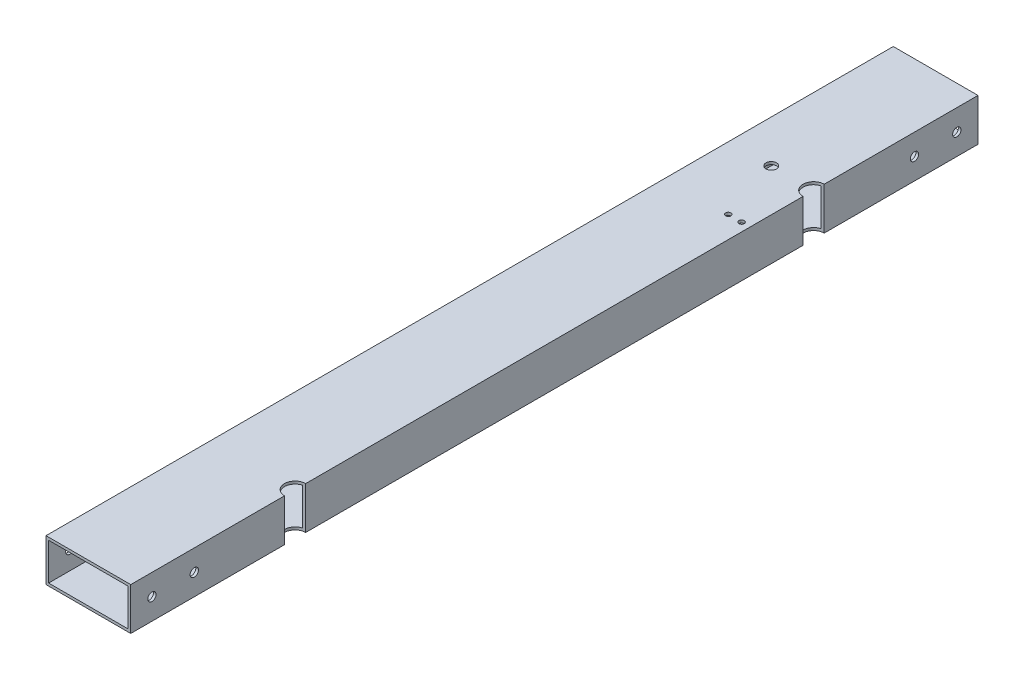
from build123d import *

# Parameters (mm, degrees)
BOSS_EXTRUDE1_DEPTH             = 254.000001
BOSS_EXTRUDE1_DEPTH_BACK        = 254.000001
SKETCH3_W                       = 50.8
SKETCH3_H                       = 25.4
SKETCH3_W_2                     = 47.625
SKETCH3_H_2                     = 22.225
F_10_CLEARANCE_HOLE1_D          = 4.9784
SKETCH6_R                       = 6.35
CUT_EXTRUDE1_DEPTH              = 257.527426425
F_1_4_0_25_DIAMETER_HOLE1_D     = 6.35
F_1_4_0_25_DIAMETER_HOLE1_DEPTH = 5.08
F_1_4_0_25_DIAMETER_HOLE1_TIP   = 1.907732465
F_3_2_3_2_DIAMETER_HOLE1_D      = 3.2


with BuildPart() as part:
    # Sketch3 → Boss-Extrude1 (new, two sides: drawn at the far end of the back side and taken through both)
    with BuildSketch(Plane.XY.offset(-BOSS_EXTRUDE1_DEPTH_BACK)):
        Rectangle(SKETCH3_W, SKETCH3_H)
        Rectangle(SKETCH3_W_2, SKETCH3_H_2, mode=Mode.SUBTRACT)
    extrude(amount=BOSS_EXTRUDE1_DEPTH + BOSS_EXTRUDE1_DEPTH_BACK)

    # #10 Clearance Hole1 (through all)
    with Locations(Plane(origin=(25.4, 0, 0), x_dir=(0, 0, -1), z_dir=(1, 0, 0))):
        with Locations((-215.900000508, 0), (-241.300000508, 0), (215.899999492, 0), (241.299999492, 0)):
            Hole(F_10_CLEARANCE_HOLE1_D / 2)

    # Sketch6 → Cut-Extrude1 (cut, through all)
    with BuildSketch(Plane(origin=(0, 12.7, 0), x_dir=(1, 0, 0), z_dir=(0, 1, 0))):
        with Locations((25.4, -155.448000508)):
            Circle(SKETCH6_R)
        with Locations((25.4, 155.448000508)):
            Circle(SKETCH6_R)
    extrude(amount=-CUT_EXTRUDE1_DEPTH, mode=Mode.SUBTRACT)

    # 1/4 (0.25) Diameter Hole1
    with Locations(Plane(origin=(0, 12.7, 0), x_dir=(1, 0, 0), z_dir=(0, 1, 0))):
        with Locations((0, 155.448000508)):
            Hole(F_1_4_0_25_DIAMETER_HOLE1_D / 2, depth=F_1_4_0_25_DIAMETER_HOLE1_DEPTH)
            with Locations((0, 0, -(F_1_4_0_25_DIAMETER_HOLE1_DEPTH + F_1_4_0_25_DIAMETER_HOLE1_TIP / 2))):  # 118° drill point
                Cone(0, F_1_4_0_25_DIAMETER_HOLE1_D / 2, F_1_4_0_25_DIAMETER_HOLE1_TIP, mode=Mode.SUBTRACT)

    # Ø3.2 (3.2) Diameter Hole1 (through all)
    with Locations(Plane(origin=(0, 12.7, 0), x_dir=(1, 0, 0), z_dir=(0, 1, 0))):
        with Locations((20.32, 117.348000508), (12.32, 117.348000508)):
            Hole(F_3_2_3_2_DIAMETER_HOLE1_D / 2)


solid = part.part
